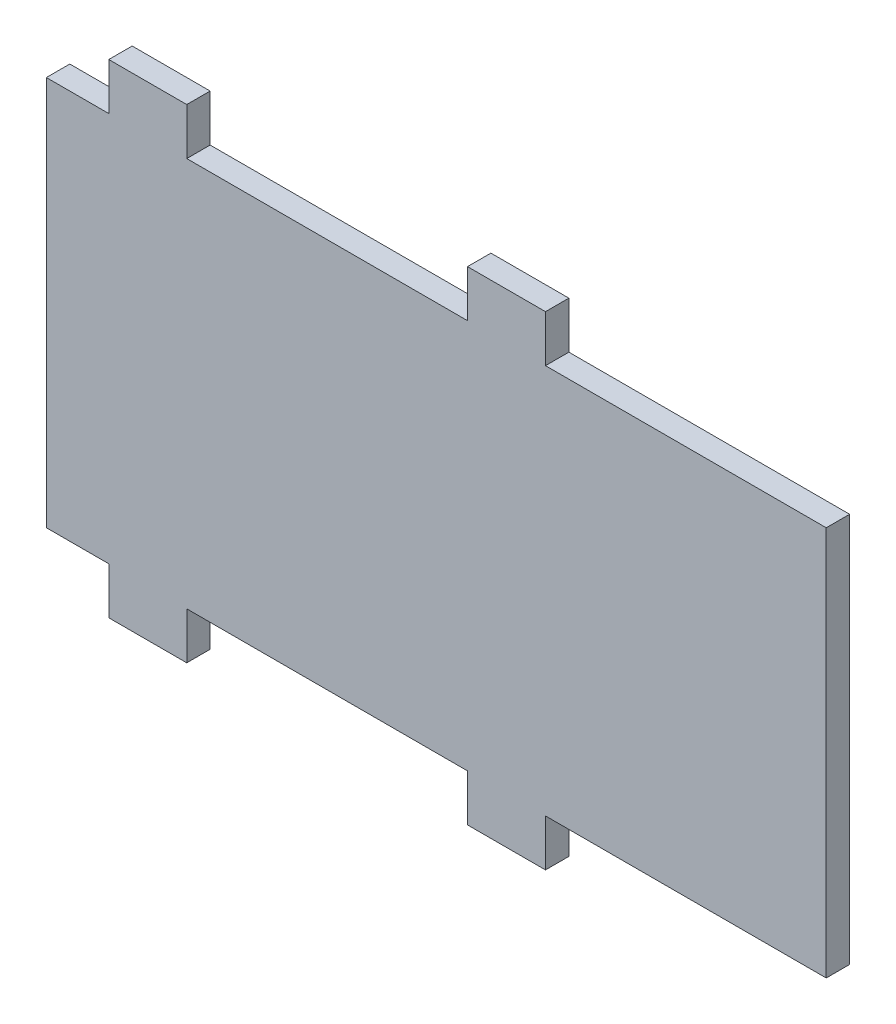
from build123d import *

# Parameters (mm, degrees)
ESQUISSE1_W             = 100
ESQUISSE1_H             = 62
BOSS_EXTRU_1_DEPTH      = 3
ESQUISSE2_W             = 8
ESQUISSE2_H             = 6
ESQUISSE2_W_2           = 36
ENL_V_MAT_EXTRU_1_DEPTH = 3


with BuildPart() as part:
    # Esquisse1 → Boss.-Extru.1 (new body)
    with BuildSketch(Plane.XY):
        with Locations((-50, 31)):
            Rectangle(ESQUISSE1_W, ESQUISSE1_H)
    extrude(amount=BOSS_EXTRU_1_DEPTH)

    # Esquisse2 → Enlèv. mat.-Extru.1 (cut)
    with BuildSketch(Plane.XY.offset(3)):
        with Locations((-96, 3)):
            Rectangle(ESQUISSE2_W, ESQUISSE2_H)
        with Locations((-64, 3)):
            Rectangle(ESQUISSE2_W_2, ESQUISSE2_H)
        with Locations((-18, 3)):
            Rectangle(ESQUISSE2_W_2, ESQUISSE2_H)
        with Locations((-18, 59)):
            Rectangle(ESQUISSE2_W_2, ESQUISSE2_H)
        with Locations((-64, 59)):
            Rectangle(ESQUISSE2_W_2, ESQUISSE2_H)
        with Locations((-96, 59)):
            Rectangle(ESQUISSE2_W, ESQUISSE2_H)
    extrude(amount=-ENL_V_MAT_EXTRU_1_DEPTH, mode=Mode.SUBTRACT)


solid = part.part
